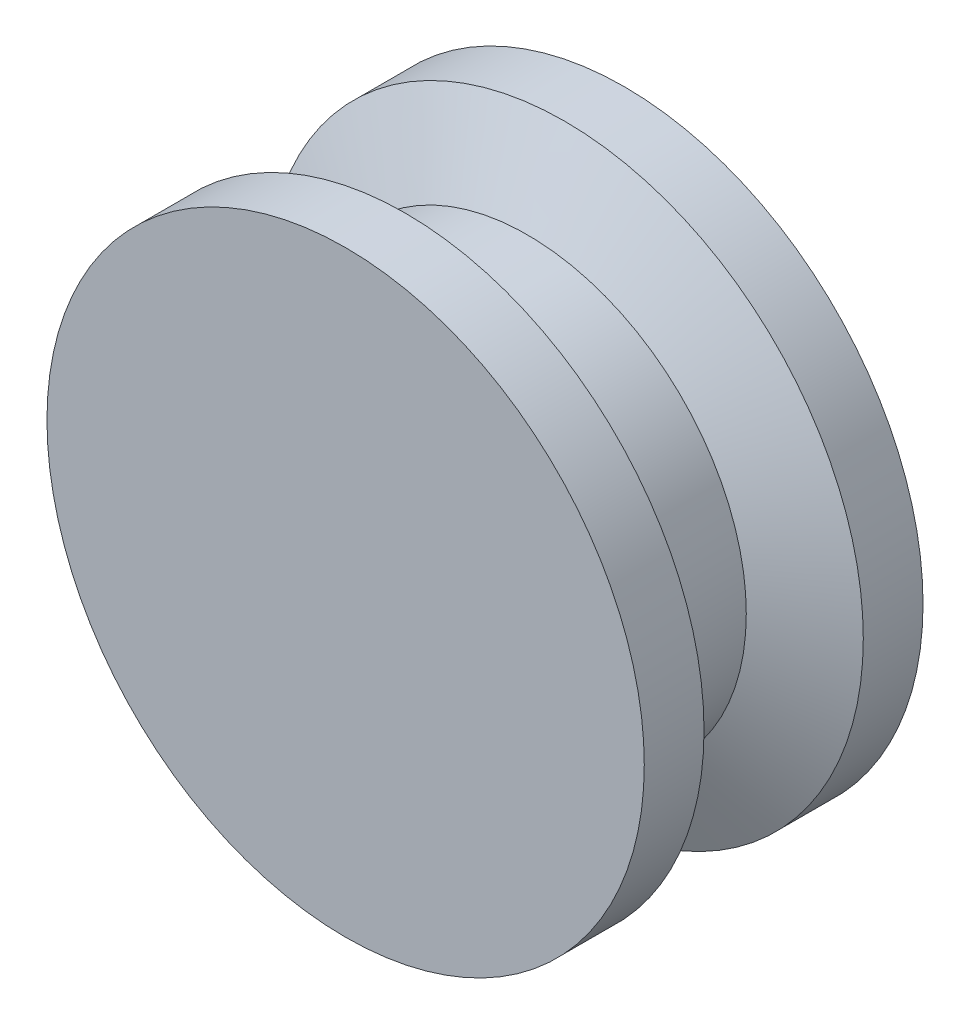
from build123d import *


with BuildPart() as part:
    # Sketch1 → Revolve2 (revolve)
    with BuildSketch(Plane(origin=(0, 0, 0), x_dir=(1, 0, 0), z_dir=(0, 1, 0)), mode=Mode.PRIVATE) as revolve2_sk:
        Polygon((0, 70), (150, 70), (150, 40), (109.920106529, 21.310438737), (109.920106529, -21.310438737), (150, -40), (150, -70), (0, -70), align=None)
    revolve(revolve2_sk.sketch.rotate(Axis((0, 0, -161.830826549), (0, 0, 1)), 180), axis=Axis((0, 0, -161.830826549), (0, 0, 1)))


solid = part.part
